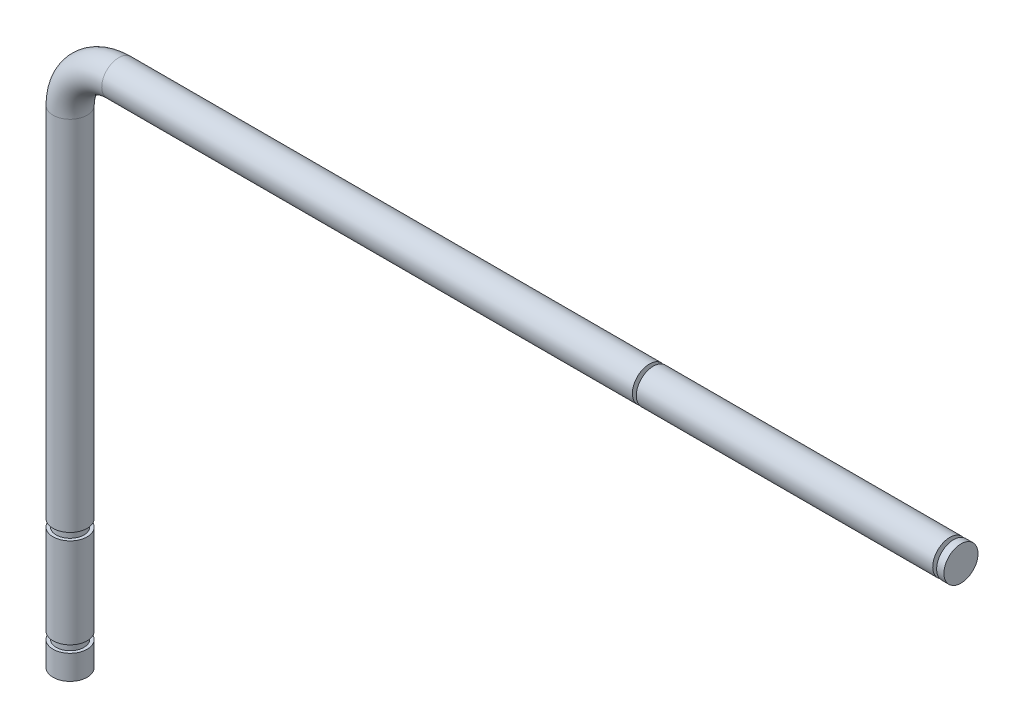
from build123d import *

# Parameters (mm, degrees)
WYCI_GNI_CIE_PO_CIE_CE1_PROFILE_R = 3.5
SZKIC26_R                         = 4
SZKIC26_R_2                       = 2.85
WYTNIJ_WYCI_GNI_CIE1_DEPTH        = 1.5
SZKIC36_R                         = 4
SZKIC36_R_2                       = 2.85
WYTNIJ_WYCI_GNI_CIE3_DEPTH        = 1.5
SZKIC46_R                         = 4
SZKIC46_R_2                       = 1.6
WYTNIJ_WYCI_GNI_CIE4_DEPTH        = 0.8
WYTNIJ_WYCI_GNI_CIE5_START        = 0.8
SZKIC53_R                         = 4
SZKIC53_R_2                       = 1.6
WYTNIJ_WYCI_GNI_CIE5_DEPTH        = 0.8


with BuildPart() as part:
    # Wyciągnięcie po ścieżce1: sweep along a path in Szkic1
    with BuildLine(Plane.XY) as wyci_gni_cie_po_cie_ce1_path:
        Line((183, 0), (10, 0))
        ThreePointArc((10, 0), (2.928932188, -2.928932188), (0, -10))
        Line((0, -10), (0, -110))
    # Wyciągnięcie po ścieżce1 profile (on start of the path) → Wyciągnięcie po ścieżce1 (sweep)
    with BuildSketch(Plane(origin=(183, 0, 0), x_dir=(0, 0, -1), z_dir=(-1, 0, 0))):
        Circle(WYCI_GNI_CIE_PO_CIE_CE1_PROFILE_R)
    sweep(path=wyci_gni_cie_po_cie_ce1_path.line)

    # Szkic26 → Wytnij-wyciągnięcie1 (cut)
    with BuildSketch(Plane(origin=(0, -105, 0), x_dir=(-1, 0, 0), z_dir=(0, -1, 0))):
        Circle(SZKIC26_R)
        with Locations(Location((0, 0, 0), (0, 0, 180))):
            Circle(SZKIC26_R_2, mode=Mode.SUBTRACT)
    extrude(amount=-WYTNIJ_WYCI_GNI_CIE1_DEPTH, mode=Mode.SUBTRACT)

    # Szkic36 → Wytnij-wyciągnięcie3 (cut)
    with BuildSketch(Plane(origin=(0, -85, 0), x_dir=(-1, 0, 0), z_dir=(0, -1, 0))):
        Circle(SZKIC36_R)
        with Locations(Location((0, 0, 0), (0, 0, 180))):
            Circle(SZKIC36_R_2, mode=Mode.SUBTRACT)
    extrude(amount=-WYTNIJ_WYCI_GNI_CIE3_DEPTH, mode=Mode.SUBTRACT)

    # Szkic46 → Wytnij-wyciągnięcie4 (cut)
    with BuildSketch(Plane(origin=(181.5, 0, 0), x_dir=(0, 0, -1), z_dir=(1, 0, 0))):
        Circle(SZKIC46_R)
        with Locations(Location((0, 0, 0), (0, 0, 90))):
            Circle(SZKIC46_R_2, mode=Mode.SUBTRACT)
    extrude(amount=-WYTNIJ_WYCI_GNI_CIE4_DEPTH, mode=Mode.SUBTRACT)

    # Szkic53 → Wytnij-wyciągnięcie5 (cut)
    with BuildSketch(Plane(origin=(119, 0, 0), x_dir=(0, 0, -1), z_dir=(1, 0, 0)).offset(WYTNIJ_WYCI_GNI_CIE5_START)):
        Circle(SZKIC53_R)
        with Locations(Location((0, 0, 0), (0, 0, 90))):
            Circle(SZKIC53_R_2, mode=Mode.SUBTRACT)
    extrude(amount=-WYTNIJ_WYCI_GNI_CIE5_DEPTH, mode=Mode.SUBTRACT)


solid = part.part
